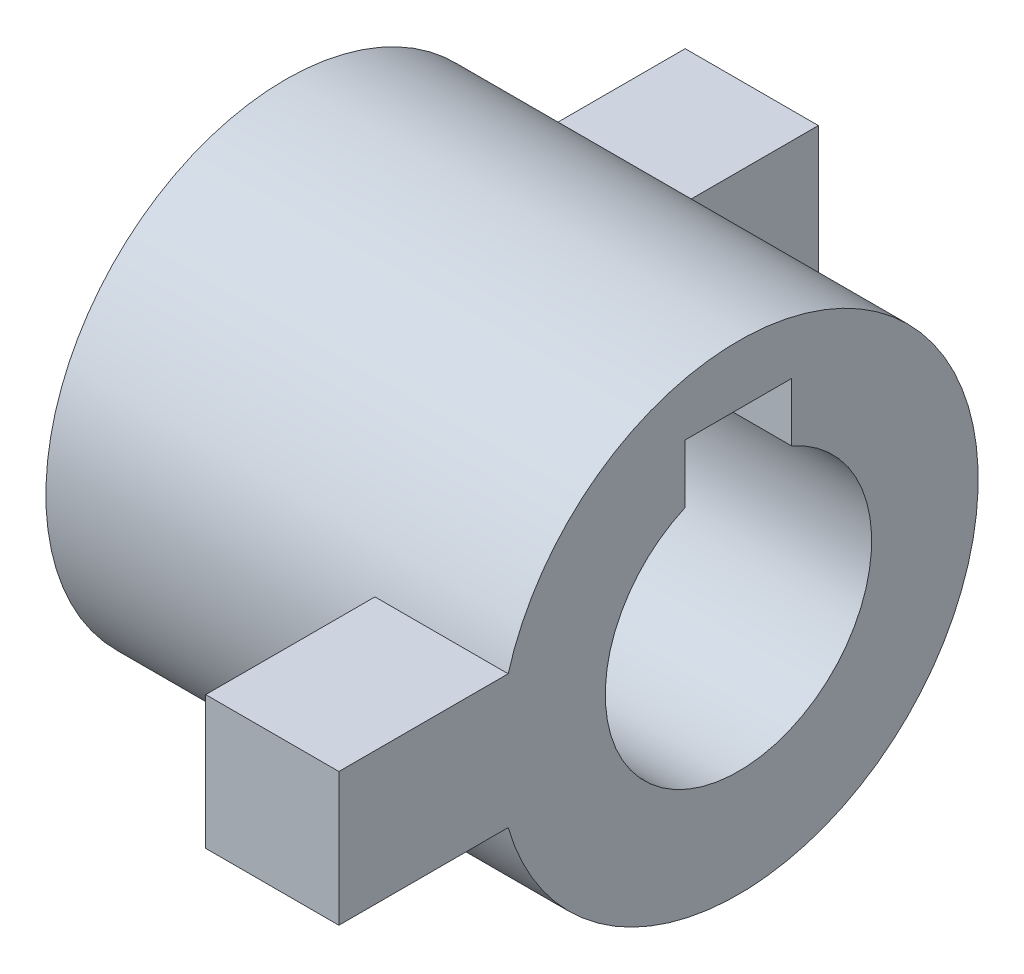
from build123d import *

# Parameters (mm, degrees)
SKETCH1_R           = 9
BOSS_EXTRUDE1_DEPTH = 17
SKETCH3_W           = 5
SKETCH3_H           = 15
BOSS_EXTRUDE3_DEPTH = 2.5
SKETCH4_R           = 5
CUT_EXTRUDE1_DEPTH  = 25.392621835


with BuildPart() as part:
    # Sketch1 → Boss-Extrude1 (new body)
    with BuildSketch(Plane(origin=(0, 0, 0), x_dir=(0, 0, -1), z_dir=(1, 0, 0))):
        Circle(SKETCH1_R)
        with BuildLine():
            ThreePointArc((5, 0), (-2.738612788, -4.183300133), (-2, 4.582575695))
            Line((-2, 4.582575695), (-2, 6.78))
            Line((-2, 6.78), (2, 6.78))
            Line((2, 6.78), (2, 4.582575695))
            ThreePointArc((2, 4.582575695), (4.183300133, 2.738612788), (5, 0))
        make_face(mode=Mode.SUBTRACT)
    extrude(amount=BOSS_EXTRUDE1_DEPTH)

    # Sketch3 → Boss-Extrude3 (add)
    with BuildSketch(Plane(origin=(0, 0, 0), x_dir=(1, 0, 0), z_dir=(0, 1, 0))):
        with Locations((2.5, 7.5)):
            Rectangle(SKETCH3_W, SKETCH3_H)
        with Locations((14.5, -7.5)):
            Rectangle(SKETCH3_W, SKETCH3_H)
    boss_extrude3 = extrude(amount=BOSS_EXTRUDE3_DEPTH)

    # Mirror1: Boss-Extrude3 across plane
    add(boss_extrude3.mirror(Plane(origin=(0, 0, 0), x_dir=(0, 0, 1), z_dir=(0, -1, 0))))

    # Sketch4 → Cut-Extrude1 (cut, through all)
    with BuildSketch(Plane.ZY):
        Circle(SKETCH4_R)
    extrude(amount=-CUT_EXTRUDE1_DEPTH, mode=Mode.SUBTRACT)


solid = part.part
